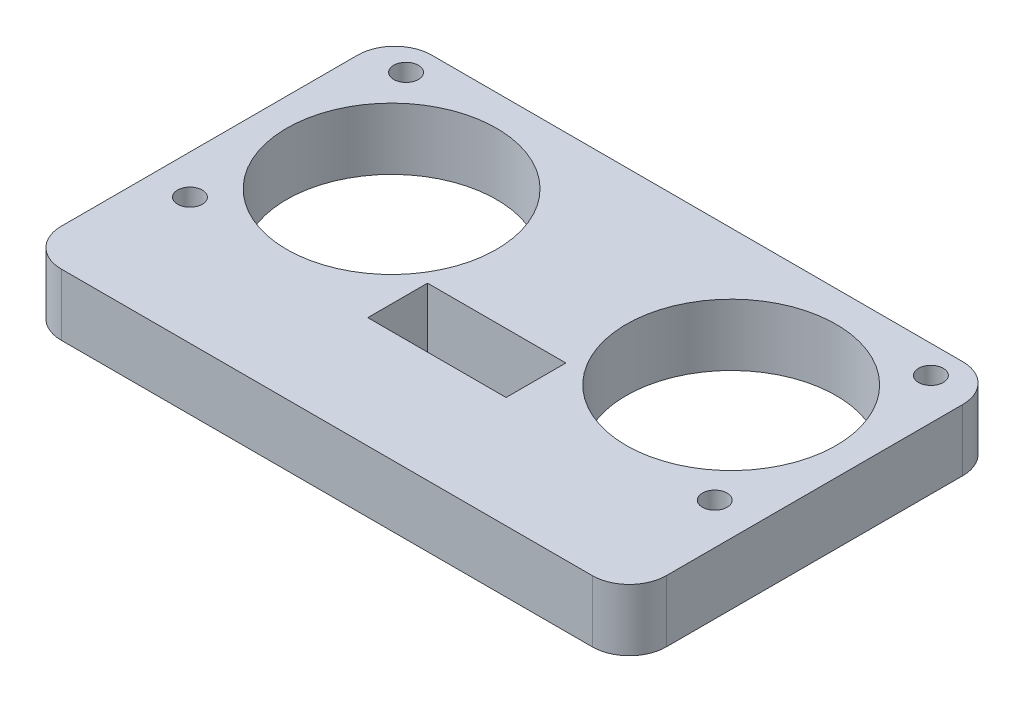
from build123d import *

# Parameters (mm, degrees)
SKETCH1_R           = 21
SKETCH1_R_2         = 20
BOSS_EXTRUDE1_DEPTH = 3.5
SKETCH2_R           = 3.55
SKETCH2_R_2         = 6.55
SKETCH2_R_3         = 2.55
SKETCH2_R_4         = 8.5
SKETCH2_W           = 11.2
SKETCH2_H           = 4.84
BOSS_EXTRUDE2_DEPTH = 5
SKETCH3_W           = 11.2
SKETCH3_H           = 4.84
SKETCH3_W_2         = 49
SKETCH3_H_2         = 8
SKETCH3_R           = 8.5
IGNORE_DEPTH        = 5
SKETCH4_R           = 8.5
SKETCH4_W           = 11.2
SKETCH4_H           = 4.84
CUT_EXTRUDE2_DEPTH  = 71.901339903
FILLET1_R           = 3
SKETCH5_W           = 42
SKETCH5_H           = 3.5
CUT_EXTRUDE3_DEPTH  = 25
CUT_EXTRUDE5_DEPTH  = 10
FILLET2_R           = 3
SKETCH8_R           = 1
CUT_EXTRUDE6_DEPTH  = 20


with BuildPart() as part:
    # Sketch1 → Boss-Extrude1 (new body)
    with BuildSketch(Plane(origin=(0, 0, 0), x_dir=(1, 0, 0), z_dir=(0, 1, 0))):
        with Locations(Location((0, 0, 0), (0, 0, 90))):
            Circle(SKETCH1_R)
        with Locations(Location((0, 0, 0), (0, 0, 90))):
            Circle(SKETCH1_R_2, mode=Mode.SUBTRACT)
    extrude(amount=BOSS_EXTRUDE1_DEPTH)

    # Sketch2 → Boss-Extrude2 (add)
    with BuildSketch(Plane(origin=(0, 3.5, 0), x_dir=(1, 0, 0), z_dir=(0, 1, 0))):
        Polygon((-29, -5), (-29, -29), (29, -29), (29, -5), (39, -5), (39, 5), (29, 5), (29, 29), (24.5, 29), (24.5, 51), (-24.5, 51), (-24.5, 29), (-29, 29), (-29, 5), (-39, 5), (-39, -5), align=None)
        with Locations(Location((-23.55, -23.55, 0), (0, 0, 270))):
            Circle(SKETCH2_R, mode=Mode.SUBTRACT)
        with Locations(Location((23.55, -23.55, 0), (0, 0, 270))):
            Circle(SKETCH2_R, mode=Mode.SUBTRACT)
        with Locations(Location((0, 0, 0), (0, 0, 270))):
            Circle(SKETCH2_R_2, mode=Mode.SUBTRACT)
        with Locations(Location((-23.55, 23.55, 0), (0, 0, 270))):
            Circle(SKETCH2_R, mode=Mode.SUBTRACT)
        with Locations(Location((23.55, 23.55, 0), (0, 0, 270))):
            Circle(SKETCH2_R, mode=Mode.SUBTRACT)
        with Locations(Location((-34, 0, 0), (0, 0, 270))):
            Circle(SKETCH2_R_3, mode=Mode.SUBTRACT)
        with Locations(Location((34, 0, 0), (0, 0, 270))):
            Circle(SKETCH2_R_3, mode=Mode.SUBTRACT)
        with Locations(Location((13.76, 39, 0), (0, 0, 270))):
            Circle(SKETCH2_R_4, mode=Mode.SUBTRACT)
        with Locations(Location((-13.76, 39, 0), (0, 0, 270))):
            Circle(SKETCH2_R_4, mode=Mode.SUBTRACT)
        with Locations((0, 46.28)):
            Rectangle(SKETCH2_W, SKETCH2_H, mode=Mode.SUBTRACT)
    extrude(amount=BOSS_EXTRUDE2_DEPTH)

    # Sketch3 → Ignore (add)
    with BuildSketch(Plane(origin=(0, 3.5, 0), x_dir=(1, 0, 0), z_dir=(0, 1, 0))):
        with Locations((0, 46.28)):
            Rectangle(SKETCH3_W, SKETCH3_H)
        with Locations((0, 55)):
            Rectangle(SKETCH3_W_2, SKETCH3_H_2)
        with Locations((13.76, 39)):
            Circle(SKETCH3_R)
        with Locations((-13.76, 39)):
            Circle(SKETCH3_R)
    extrude(amount=IGNORE_DEPTH)

    # Sketch4 → Cut-Extrude2 (cut, through all)
    with BuildSketch(Plane(origin=(0, 3.5, 0), x_dir=(1, 0, 0), z_dir=(0, 1, 0))):
        with Locations(Location((-13.75, 48, 0), (0, 0, 270))):
            Circle(SKETCH4_R)
        with Locations(Location((13.75, 48, 0), (0, 0, 270))):
            Circle(SKETCH4_R)
        with Locations((-0.079148889, 40.42)):
            Rectangle(SKETCH4_W, SKETCH4_H)
    extrude(amount=CUT_EXTRUDE2_DEPTH, mode=Mode.SUBTRACT)

    # Fillet1
    fillet1_edges = [part.edges().sort_by_distance(p)[0] for p in [
        (-29, 6, 29),
        (29, 6, 29),
        (39, 6, 5),
        (39, 6, -5),
        (29, 6, -29),
        (-29, 6, -29),
        (-39, 6, -5),
        (-39, 6, 5),
        (24.5, 6, -59),
        (-24.5, 6, -59),
    ]]
    fillet(fillet1_edges, radius=FILLET1_R)

    # Sketch5 → Cut-Extrude3 (cut, symmetric)
    with BuildSketch(Plane.XY):
        with Locations((0, 1.75)):
            Rectangle(SKETCH5_W, SKETCH5_H)
    extrude(amount=CUT_EXTRUDE3_DEPTH, both=True, mode=Mode.SUBTRACT)

    # Sketch6 → Cut-Extrude5 (cut)
    with BuildSketch(Plane(origin=(0, 8.5, 0), x_dir=(1, 0, 0), z_dir=(0, 1, 0))):
        Polygon((-26, 29), (24.5, 29), (43.321910497, 29), (43.321910497, -33.14300085), (-52.072842779, -33.14300085), (-52.072842779, 29), (-38.2971121, 29), align=None)
    extrude(amount=-CUT_EXTRUDE5_DEPTH, mode=Mode.SUBTRACT)

    # Fillet2
    fillet2_edges = [part.edges().sort_by_distance(p)[0] for p in [
        (24.5, 6, -29),
        (-24.5, 6, -29),
    ]]
    fillet(fillet2_edges, radius=FILLET2_R)

    # Sketch8 → Cut-Extrude6 (cut)
    with BuildSketch(Plane.XZ.offset(-3.5)):
        with Locations(Location((-21.329148889, -39.25, 0), (0, 0, 270))):
            Circle(SKETCH8_R)
        with Locations(Location((-21.329148889, -56.75, 0), (0, 0, 270))):
            Circle(SKETCH8_R)
        with Locations(Location((21.170851111, -56.75, 0), (0, 0, 270))):
            Circle(SKETCH8_R)
        with Locations(Location((21.170851111, -39.25, 0), (0, 0, 270))):
            Circle(SKETCH8_R)
    extrude(amount=-CUT_EXTRUDE6_DEPTH, mode=Mode.SUBTRACT)


solid = part.part
